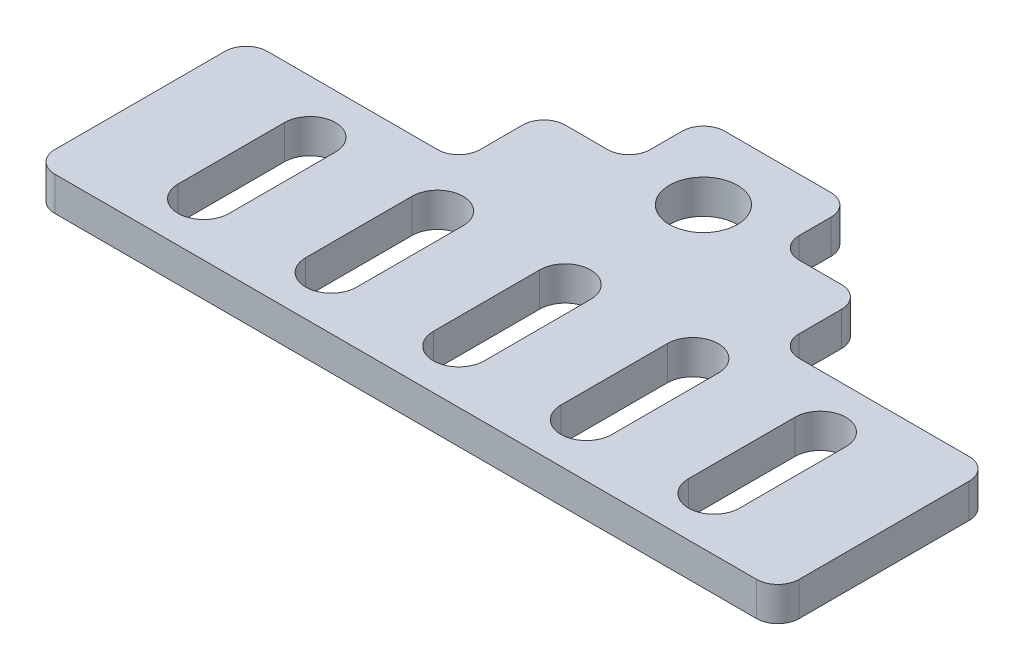
from build123d import *

# Parameters (mm, degrees)
BOSS_EXTRUDE1_DEPTH = 1.6
SKETCH2_R           = 1.6
CUT_EXTRUDE1_DEPTH  = 22.279332696
FILLET1_R           = 1
CUT_EXTRUDE2_DEPTH  = 22.279332696
LPATTERN1_COUNT     = 3
LPATTERN1_PITCH     = 6
LPATTERN1_COL_COUNT = 3
LPATTERN1_COL_PITCH = 6


with BuildPart() as part:
    # Sketch1 → Boss-Extrude1 (new body)
    with BuildSketch(Plane(origin=(0, 0, 0), x_dir=(1, 0, 0), z_dir=(0, 1, 0))):
        Polygon((3.5, 2), (7.5, 2), (7.5, -2), (17.5, -2), (17.5, -12), (-17.5, -12), (-17.5, -2), (-7.5, -2), (-7.5, 2), (-3.5, 2), (-3.5, 5.5), (3.5, 5.5), align=None)
    extrude(amount=BOSS_EXTRUDE1_DEPTH)

    # Sketch2 → Cut-Extrude1 (cut, through all)
    with BuildSketch(Plane(origin=(0, 1.6, 0), x_dir=(1, 0, 0), z_dir=(0, 1, 0))):
        with Locations(Location((0, 2, 0), (0, 0, 270))):
            Circle(SKETCH2_R)
    extrude(amount=-CUT_EXTRUDE1_DEPTH, mode=Mode.SUBTRACT)

    # Fillet1
    fillet1_edges = [part.edges().sort_by_distance(p)[0] for p in [
        (7.5, 0.8, 2),
        (17.5, 0.8, 2),
        (17.5, 0.8, 12),
        (-17.5, 0.8, 12),
        (-17.5, 0.8, 2),
        (-7.5, 0.8, 2),
        (-7.5, 0.8, -2),
        (-3.5, 0.8, -2),
        (-3.5, 0.8, -5.5),
        (3.5, 0.8, -5.5),
        (3.5, 0.8, -2),
        (7.5, 0.8, -2),
    ]]
    fillet(fillet1_edges, radius=FILLET1_R)

    # Sketch3 → Cut-Extrude2 (cut, through all)
    with BuildSketch(Plane(origin=(0, 1.6, 0), x_dir=(1, 0, 0), z_dir=(0, 1, 0))):
        with BuildLine():
            Line((-1.2, -9.5), (-1.2, -4.5))
            ThreePointArc((-1.2, -4.5), (0, -3.3), (1.2, -4.5))
            Line((1.2, -4.5), (1.2, -9.5))
            ThreePointArc((1.2, -9.5), (0, -10.7), (-1.2, -9.5))
        make_face()
    cut_extrude2 = extrude(amount=-CUT_EXTRUDE2_DEPTH, mode=Mode.SUBTRACT)

    # LPattern1: Cut-Extrude2 ×3
    with Locations(*[(i * LPATTERN1_PITCH, 0, 0) for i in range(1, LPATTERN1_COUNT)]):
        add(cut_extrude2, mode=Mode.SUBTRACT)

    # LPattern1 col: Cut-Extrude2 ×3
    with Locations(*[(-i * LPATTERN1_COL_PITCH, 0, 0) for i in range(1, LPATTERN1_COL_COUNT)]):
        add(cut_extrude2, mode=Mode.SUBTRACT)


solid = part.part
